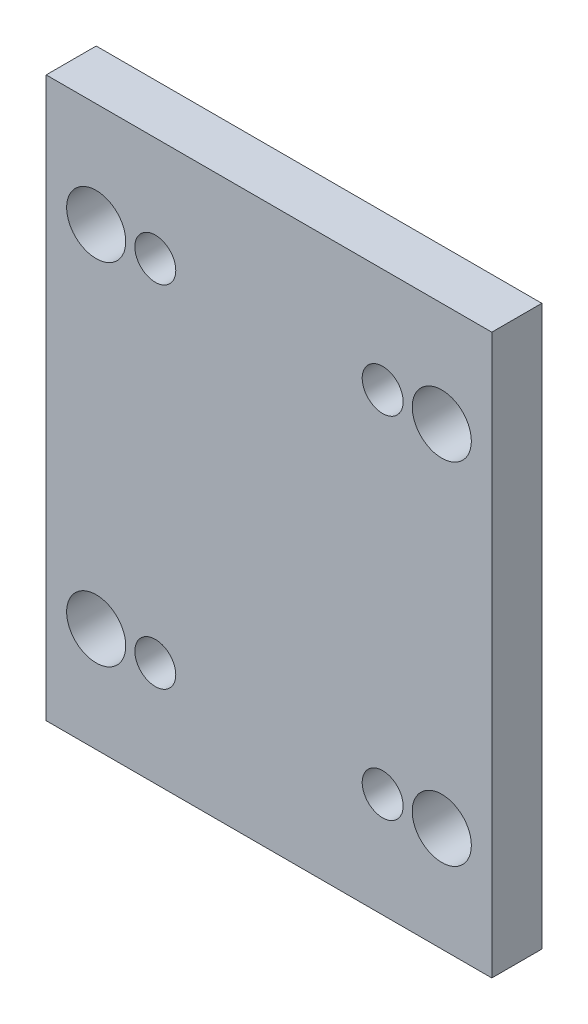
from build123d import *

# Parameters (mm, degrees)
SKETCH_1_W                   = 196
SKETCH_1_H                   = 246
EXTRUDE_1_DEPTH              = 22
HOLE_WIZARD_M101_D           = 11
HOLE_WIZARD_M101_CBORE_D     = 18
HOLE_WIZARD_M101_CBORE_DEPTH = 13
HOLE_WIZARD_M221_D           = 26


with BuildPart() as part:
    # Эскиз1 → Бобышка-Вытянуть1 (new body)
    with BuildSketch(Plane.XY.offset(22)):
        Rectangle(SKETCH_1_W, SKETCH_1_H)
    extrude(amount=-EXTRUDE_1_DEPTH)

    # Цековка для  болта с шестигранной головкой M101 (through all)
    with Locations(Plane.XY.offset(22)):
        with Locations((50, 77), (50, -77), (-50, 77), (-50, -77)):
            CounterBoreHole(HOLE_WIZARD_M101_D / 2, HOLE_WIZARD_M101_CBORE_D / 2, HOLE_WIZARD_M101_CBORE_DEPTH)

    # Отверстие с зазором M221 (through all)
    with Locations(Plane.XY.offset(22)):
        with Locations((76, 77), (76, -77), (-76, -77), (-76, 77)):
            Hole(HOLE_WIZARD_M221_D / 2)


solid = part.part
